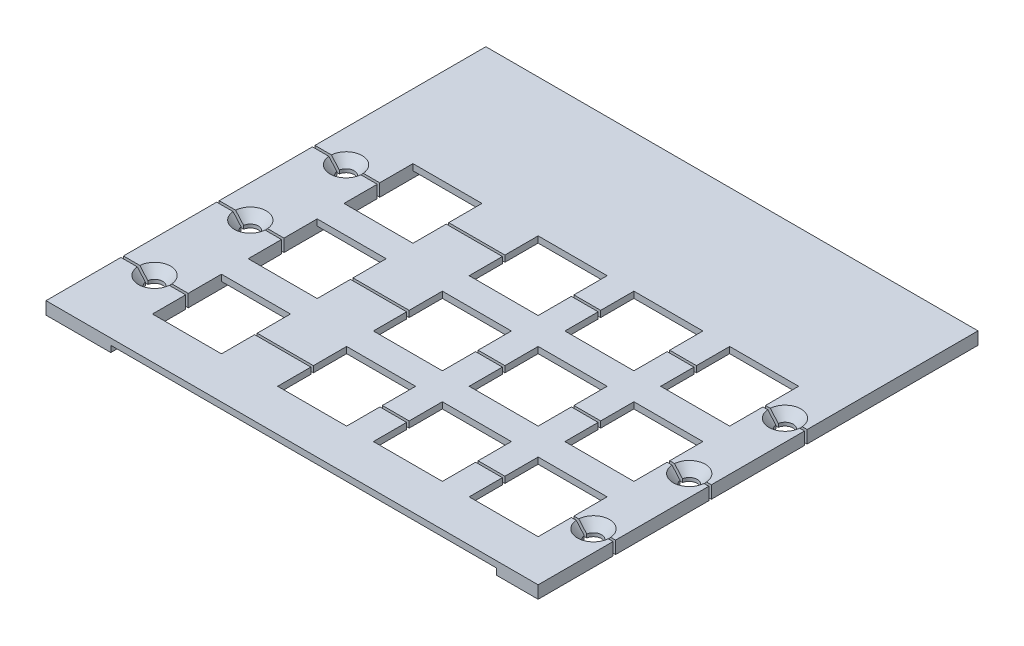
from build123d import *

# Parameters (mm, degrees)
SKETCH1_W                                     = 99.4664
SKETCH1_H                                     = 88.9
SKETCH1_W_2                                   = 13.9446
SKETCH1_H_2                                   = 13.9446
BOSS_EXTRUDE1_DEPTH                           = 1.27
SKETCH6_W                                     = 13.0937
SKETCH6_H                                     = 88.9
SKETCH6_W_2                                   = 8.4201
BOSS_EXTRUDE2_DEPTH                           = 1.27
SKETCH2_W                                     = 99.4664
SKETCH2_H                                     = 0.508
CUT_EXTRUDE_THIN2_DEPTH                       = 67.750620089
CSK_FOR_4_FLAT_HEAD_SOCKET_CAP_SCREW1_A_COUNT = 2
CSK_FOR_4_FLAT_HEAD_SOCKET_CAP_SCREW1_A_PITCH = 19.3548
CSK_FOR_4_FLAT_HEAD_SOCKET_CAP_SCRE_2_COUNT   = 2
CSK_FOR_4_FLAT_HEAD_SOCKET_CAP_SCRE_2_PITCH   = 38.7096
CSK_FOR_4_FLAT_HEAD_SOCKET_CAP_SCRE_3_COUNT   = 2
CSK_FOR_4_FLAT_HEAD_SOCKET_CAP_SCRE_3_PITCH   = 88.7095
CSK_FOR_4_FLAT_HEAD_SOCKET_CAP_SCRE_4_COUNT   = 2
CSK_FOR_4_FLAT_HEAD_SOCKET_CAP_SCRE_4_PITCH   = 90.796385794
CSK_FOR_4_FLAT_HEAD_SOCKET_CAP_SCRE_5_COUNT   = 2
CSK_FOR_4_FLAT_HEAD_SOCKET_CAP_SCRE_5_PITCH   = 96.7874399


with BuildPart() as part:
    # Sketch1 → Boss-Extrude1 (new body)
    with BuildSketch(Plane(origin=(0, 0, 0), x_dir=(1, 0, 0), z_dir=(0, 1, 0))):
        Rectangle(SKETCH1_W, SKETCH1_H)
        with Locations((-4.3688, 9.652)):
            Rectangle(SKETCH1_W_2, SKETCH1_H_2, mode=Mode.SUBTRACT)
        with Locations((14.986, 9.652)):
            Rectangle(SKETCH1_W_2, SKETCH1_H_2, mode=Mode.SUBTRACT)
        with Locations((34.3408, 9.652)):
            Rectangle(SKETCH1_W_2, SKETCH1_H_2, mode=Mode.SUBTRACT)
        with Locations((-4.3688, -9.7028)):
            Rectangle(SKETCH1_W_2, SKETCH1_H_2, mode=Mode.SUBTRACT)
        with Locations((14.986, -9.7028)):
            Rectangle(SKETCH1_W_2, SKETCH1_H_2, mode=Mode.SUBTRACT)
        with Locations((34.3408, -9.7028)):
            Rectangle(SKETCH1_W_2, SKETCH1_H_2, mode=Mode.SUBTRACT)
        with Locations((-4.3688, -29.0576)):
            Rectangle(SKETCH1_W_2, SKETCH1_H_2, mode=Mode.SUBTRACT)
        with Locations((14.986, -29.0576)):
            Rectangle(SKETCH1_W_2, SKETCH1_H_2, mode=Mode.SUBTRACT)
        with Locations((34.3408, -29.0576)):
            Rectangle(SKETCH1_W_2, SKETCH1_H_2, mode=Mode.SUBTRACT)
        with Locations((-29.6672, 9.652)):
            Rectangle(SKETCH1_W_2, SKETCH1_H_2, mode=Mode.SUBTRACT)
        with Locations((-29.6672, -9.7028)):
            Rectangle(SKETCH1_W_2, SKETCH1_H_2, mode=Mode.SUBTRACT)
        with Locations((-29.6672, -29.0576)):
            Rectangle(SKETCH1_W_2, SKETCH1_H_2, mode=Mode.SUBTRACT)
    extrude(amount=BOSS_EXTRUDE1_DEPTH)

    # Sketch6 → Boss-Extrude2 (add)
    with BuildSketch(Plane.XZ):
        with Locations((-43.18635, 0)):
            Rectangle(SKETCH6_W, SKETCH6_H)
        with Locations((45.52315, 0)):
            Rectangle(SKETCH6_W_2, SKETCH6_H)
    extrude(amount=BOSS_EXTRUDE2_DEPTH)

    # Sketch2 → Cut-Extrude-Thin2 (cut, through all)
    with BuildSketch(Plane(origin=(0, 1.27, 0), x_dir=(1, 0, 0), z_dir=(0, 1, 0))):
        with Locations((0, 9.652)):
            Rectangle(SKETCH2_W, SKETCH2_H)
        with Locations((0, -9.7028)):
            Rectangle(SKETCH2_W, SKETCH2_H)
        with Locations((0, -29.0576)):
            Rectangle(SKETCH2_W, SKETCH2_H)
    extrude(amount=-CUT_EXTRUDE_THIN2_DEPTH, mode=Mode.SUBTRACT)


with BuildPart() as cut_extrude_thin2_piece_1:
    # of the separate pieces the step leaves, piece 1, a body of its own (cut_extrude_thin2_pieces)
    add(part.part.solids().sort_by_distance((-49.7332, 1.27, -44.45))[0])


with BuildPart() as cut_extrude_thin2_piece_2:
    # of the separate pieces the step leaves, piece 2, a body of its own (cut_extrude_thin2_pieces)
    add(part.part.solids().sort_by_distance((-49.7332, 1.27, -9.398))[0])


with BuildPart() as cut_extrude_thin2_piece_3:
    # of the separate pieces the step leaves, piece 3, a body of its own (cut_extrude_thin2_pieces)
    add(part.part.solids().sort_by_distance((-49.7332, 1.27, 9.9568))[0])


with BuildPart() as cut_extrude_thin2_piece_4:
    # of the separate pieces the step leaves, piece 4, a body of its own (cut_extrude_thin2_pieces)
    add(part.part.solids().sort_by_distance((-49.7332, 1.27, 44.45))[0])


with BuildPart() as csk_for_4_flat_head_socket_cap_screw1_tool:
    # Sketch7 → CSK for #4 Flat Head Socket Cap Screw1 (revolve)
    with BuildSketch(Plane(origin=(-43.18635, 1.27, -9.652), x_dir=(0, 0, 1), z_dir=(1, 0, 0))):
        Polygon((0, 0), (0, 2.54), (1.63195, 2.54), (1.63195, 1.848124365), (3.2385, 0), align=None)
    csk_for_4_flat_head_socket_cap_screw1 = revolve(axis=Axis((-43.18635, 7.62, -9.652), (0, -1, 0)))


with BuildPart() as cut_extrude_thin2_piece_1_1:
    add(cut_extrude_thin2_piece_1.part)

    # CSK for #4 Flat Head Socket Cap Screw1: cut by csk_for_4_flat_head_socket_cap_screw1_tool
    add(csk_for_4_flat_head_socket_cap_screw1_tool.part, mode=Mode.SUBTRACT)


with BuildPart() as cut_extrude_thin2_piece_2_1:
    add(cut_extrude_thin2_piece_2.part)

    # CSK for #4 Flat Head Socket Cap Screw1: cut by csk_for_4_flat_head_socket_cap_screw1_tool
    add(csk_for_4_flat_head_socket_cap_screw1_tool.part, mode=Mode.SUBTRACT)


with BuildPart() as csk_for_4_flat_head_socket_cap_screw1_a_tool:
    # CSK for #4 Flat Head Socket Cap Screw1 a: CSK for #4 Flat Head Socket Cap Screw1 ×2
    with Locations(*[(0, 0, i * CSK_FOR_4_FLAT_HEAD_SOCKET_CAP_SCREW1_A_PITCH) for i in range(1, CSK_FOR_4_FLAT_HEAD_SOCKET_CAP_SCREW1_A_COUNT)]):
        add(csk_for_4_flat_head_socket_cap_screw1)


with BuildPart() as cut_extrude_thin2_piece_2_2:
    add(cut_extrude_thin2_piece_2_1.part)

    # CSK for #4 Flat Head Socket Cap Screw1 a: cut by csk_for_4_flat_head_socket_cap_screw1_a_tool
    add(csk_for_4_flat_head_socket_cap_screw1_a_tool.part, mode=Mode.SUBTRACT)


with BuildPart() as cut_extrude_thin2_piece_3_1:
    add(cut_extrude_thin2_piece_3.part)

    # CSK for #4 Flat Head Socket Cap Screw1 a: cut by csk_for_4_flat_head_socket_cap_screw1_a_tool
    add(csk_for_4_flat_head_socket_cap_screw1_a_tool.part, mode=Mode.SUBTRACT)


with BuildPart() as csk_for_4_flat_head_socket_cap_scre_2_tool:
    # CSK for _4 Flat Head Socket Cap Scre 2: CSK for #4 Flat Head Socket Cap Screw1 ×2
    with Locations(*[(0, 0, i * CSK_FOR_4_FLAT_HEAD_SOCKET_CAP_SCRE_2_PITCH) for i in range(1, CSK_FOR_4_FLAT_HEAD_SOCKET_CAP_SCRE_2_COUNT)]):
        add(csk_for_4_flat_head_socket_cap_screw1)


with BuildPart() as cut_extrude_thin2_piece_3_2:
    add(cut_extrude_thin2_piece_3_1.part)

    # CSK for _4 Flat Head Socket Cap Scre 2: cut by csk_for_4_flat_head_socket_cap_scre_2_tool
    add(csk_for_4_flat_head_socket_cap_scre_2_tool.part, mode=Mode.SUBTRACT)


with BuildPart() as cut_extrude_thin2_piece_4_1:
    add(cut_extrude_thin2_piece_4.part)

    # CSK for _4 Flat Head Socket Cap Scre 2: cut by csk_for_4_flat_head_socket_cap_scre_2_tool
    add(csk_for_4_flat_head_socket_cap_scre_2_tool.part, mode=Mode.SUBTRACT)


with BuildPart() as csk_for_4_flat_head_socket_cap_scre_3_tool:
    # CSK for _4 Flat Head Socket Cap Scre 3: CSK for #4 Flat Head Socket Cap Screw1 ×2
    with Locations(*[(i * CSK_FOR_4_FLAT_HEAD_SOCKET_CAP_SCRE_3_PITCH, 0, 0) for i in range(1, CSK_FOR_4_FLAT_HEAD_SOCKET_CAP_SCRE_3_COUNT)]):
        add(csk_for_4_flat_head_socket_cap_screw1)


with BuildPart() as cut_extrude_thin2_piece_1_2:
    add(cut_extrude_thin2_piece_1_1.part)

    # CSK for _4 Flat Head Socket Cap Scre 3: cut by csk_for_4_flat_head_socket_cap_scre_3_tool
    add(csk_for_4_flat_head_socket_cap_scre_3_tool.part, mode=Mode.SUBTRACT)


with BuildPart() as cut_extrude_thin2_piece_2_3:
    add(cut_extrude_thin2_piece_2_2.part)

    # CSK for _4 Flat Head Socket Cap Scre 3: cut by csk_for_4_flat_head_socket_cap_scre_3_tool
    add(csk_for_4_flat_head_socket_cap_scre_3_tool.part, mode=Mode.SUBTRACT)


with BuildPart() as csk_for_4_flat_head_socket_cap_scre_4_tool:
    # CSK for _4 Flat Head Socket Cap Scre 4: CSK for #4 Flat Head Socket Cap Screw1 ×2
    with Locations(*[Vector(0.9770157614099922, 0, 0.21316707521672607) * (i * CSK_FOR_4_FLAT_HEAD_SOCKET_CAP_SCRE_4_PITCH) for i in range(1, CSK_FOR_4_FLAT_HEAD_SOCKET_CAP_SCRE_4_COUNT)]):
        add(csk_for_4_flat_head_socket_cap_screw1)


with BuildPart() as cut_extrude_thin2_piece_2_4:
    add(cut_extrude_thin2_piece_2_3.part)

    # CSK for _4 Flat Head Socket Cap Scre 4: cut by csk_for_4_flat_head_socket_cap_scre_4_tool
    add(csk_for_4_flat_head_socket_cap_scre_4_tool.part, mode=Mode.SUBTRACT)


with BuildPart() as cut_extrude_thin2_piece_3_3:
    add(cut_extrude_thin2_piece_3_2.part)

    # CSK for _4 Flat Head Socket Cap Scre 4: cut by csk_for_4_flat_head_socket_cap_scre_4_tool
    add(csk_for_4_flat_head_socket_cap_scre_4_tool.part, mode=Mode.SUBTRACT)


with BuildPart() as csk_for_4_flat_head_socket_cap_scre_5_tool:
    # CSK for _4 Flat Head Socket Cap Scre 5: CSK for #4 Flat Head Socket Cap Screw1 ×2
    with Locations(*[Vector(0.9165393783696331, 0, 0.39994445601584067) * (i * CSK_FOR_4_FLAT_HEAD_SOCKET_CAP_SCRE_5_PITCH) for i in range(1, CSK_FOR_4_FLAT_HEAD_SOCKET_CAP_SCRE_5_COUNT)]):
        add(csk_for_4_flat_head_socket_cap_screw1)


with BuildPart() as cut_extrude_thin2_piece_3_4:
    add(cut_extrude_thin2_piece_3_3.part)

    # CSK for _4 Flat Head Socket Cap Scre 5: cut by csk_for_4_flat_head_socket_cap_scre_5_tool
    add(csk_for_4_flat_head_socket_cap_scre_5_tool.part, mode=Mode.SUBTRACT)


with BuildPart() as cut_extrude_thin2_piece_4_2:
    add(cut_extrude_thin2_piece_4_1.part)

    # CSK for _4 Flat Head Socket Cap Scre 5: cut by csk_for_4_flat_head_socket_cap_scre_5_tool
    add(csk_for_4_flat_head_socket_cap_scre_5_tool.part, mode=Mode.SUBTRACT)


solid = Compound([cut_extrude_thin2_piece_1_2.part, cut_extrude_thin2_piece_2_4.part, cut_extrude_thin2_piece_3_4.part, cut_extrude_thin2_piece_4_2.part])
